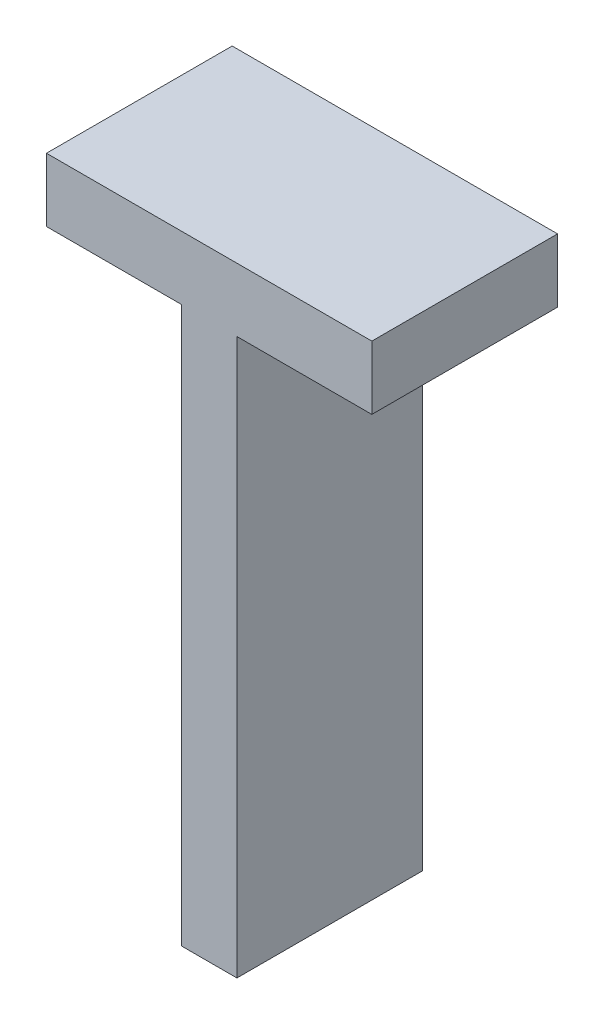
from build123d import *

# Parameters (mm, degrees)
BOSS_EXTRU_1_DEPTH = 1.5


with BuildPart() as part:
    # Esquisse1 → Boss.-Extru.1 (new body)
    with BuildSketch(Plane.XY):
        Polygon((-56.009388403, -18.382939589), (-56.009388403, -17.870119076), (-53.381183275, -17.870119076), (-53.381183275, -18.382939589), (-54.470926864, -18.382939589), (-54.470926864, -22.870119076), (-54.919644813, -22.870119076), (-54.919644813, -18.382939589), align=None)
    extrude(amount=BOSS_EXTRU_1_DEPTH)


solid = part.part
